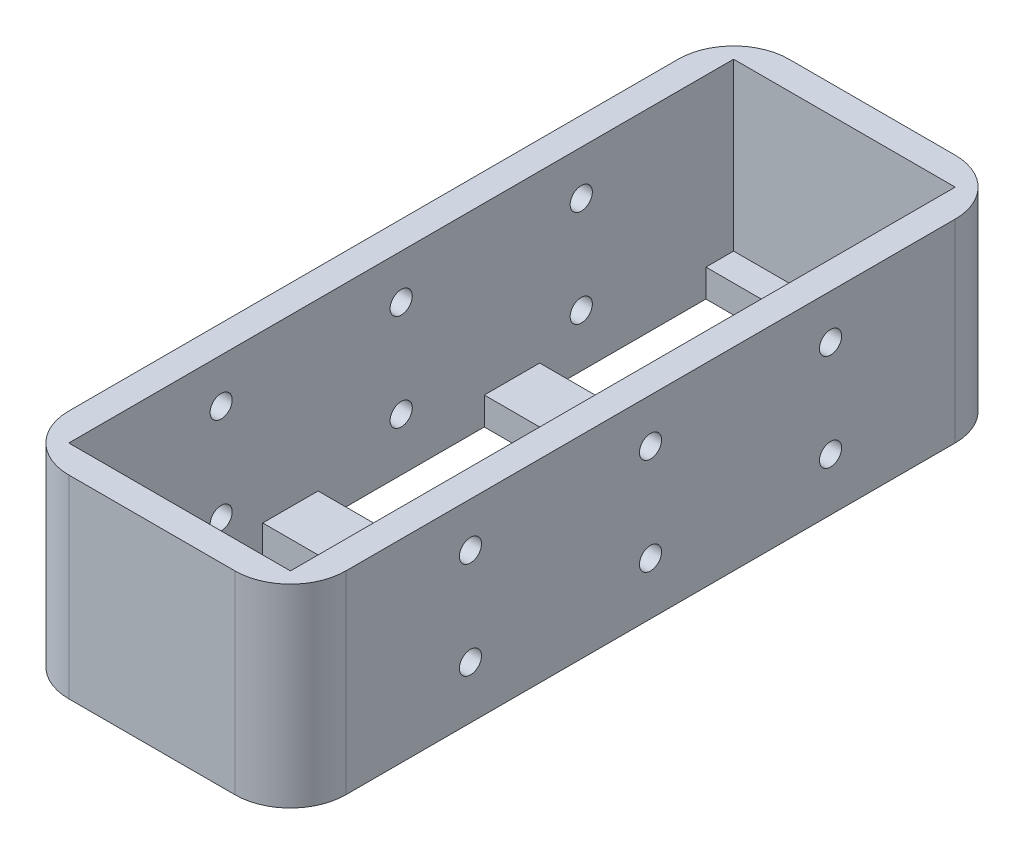
from build123d import *

# Parameters (mm, degrees)
SKETCH1_W           = 50.8
SKETCH1_H           = 38.1
MOUNT_BASE_DEPTH    = 6.35
SKETCH5_W           = 63.5
SKETCH5_H           = 165.1
BOSS_EXTRUDE2_DEPTH = 38.1
SKETCH4_R           = 2.54
CUT_EXTRUDE1_DEPTH  = 114.236721076
OUTSIDE_VERTICES_R  = 12.7


with BuildPart() as part:
    # Sketch1 → Mount Base (new body)
    with BuildSketch(Plane(origin=(0, 0, 0), x_dir=(1, 0, 0), z_dir=(0, 1, 0))):
        Polygon((-31.75, 82.55), (-31.75, -82.55), (31.75, -82.55), (31.75, 82.55), (25.4, 82.55), align=None)
        with Locations((0, -50.8)):
            Rectangle(SKETCH1_W, SKETCH1_H, mode=Mode.SUBTRACT)
        Rectangle(SKETCH1_W, SKETCH1_H, mode=Mode.SUBTRACT)
        with Locations((0, 50.8)):
            Rectangle(SKETCH1_W, SKETCH1_H, mode=Mode.SUBTRACT)
    extrude(amount=MOUNT_BASE_DEPTH)

    # Sketch5 → Boss-Extrude2 (add)
    with BuildSketch(Plane(origin=(0, 6.35, 0), x_dir=(-1, 0, 0), z_dir=(0, 1, 0))):
        Rectangle(SKETCH5_W, SKETCH5_H)
        Polygon((25.4, -76.2), (-25.4, -76.2), (-25.4, -69.85), (-25.4, -31.75), (-25.4, -19.05), (-25.4, 19.05), (-25.4, 31.75), (-25.4, 69.85), (-25.4, 76.2), (25.4, 76.2), (25.4, 69.85), (25.4, 31.75), (25.4, 19.05), (25.4, -19.05), (25.4, -31.75), (25.4, -69.85), align=None, mode=Mode.SUBTRACT)
    extrude(amount=BOSS_EXTRUDE2_DEPTH)

    # Sketch4 → Cut-Extrude1 (cut, through all)
    with BuildSketch(Plane(origin=(31.75, 0, 0), x_dir=(0, 0, -1), z_dir=(1, 0, 0))):
        with Locations((0, 34.29)):
            Circle(SKETCH4_R)
        with Locations((41.275, 34.29)):
            Circle(SKETCH4_R)
        with Locations((-41.275, 34.29)):
            Circle(SKETCH4_R)
        with Locations((-41.275, 12.065)):
            Circle(SKETCH4_R)
        with Locations((41.275, 12.065)):
            Circle(SKETCH4_R)
        with Locations((0, 12.065)):
            Circle(SKETCH4_R)
    extrude(amount=-CUT_EXTRUDE1_DEPTH, mode=Mode.SUBTRACT)

    # Outside Vertices
    outside_vertices_edges = [part.edges().sort_by_distance(p)[0] for p in [
        (31.75, 22.225, 82.55),
        (-31.75, 22.225, 82.55),
        (-31.75, 22.225, -82.55),
        (31.75, 22.225, -82.55),
    ]]
    fillet(outside_vertices_edges, radius=OUTSIDE_VERTICES_R)


solid = part.part
